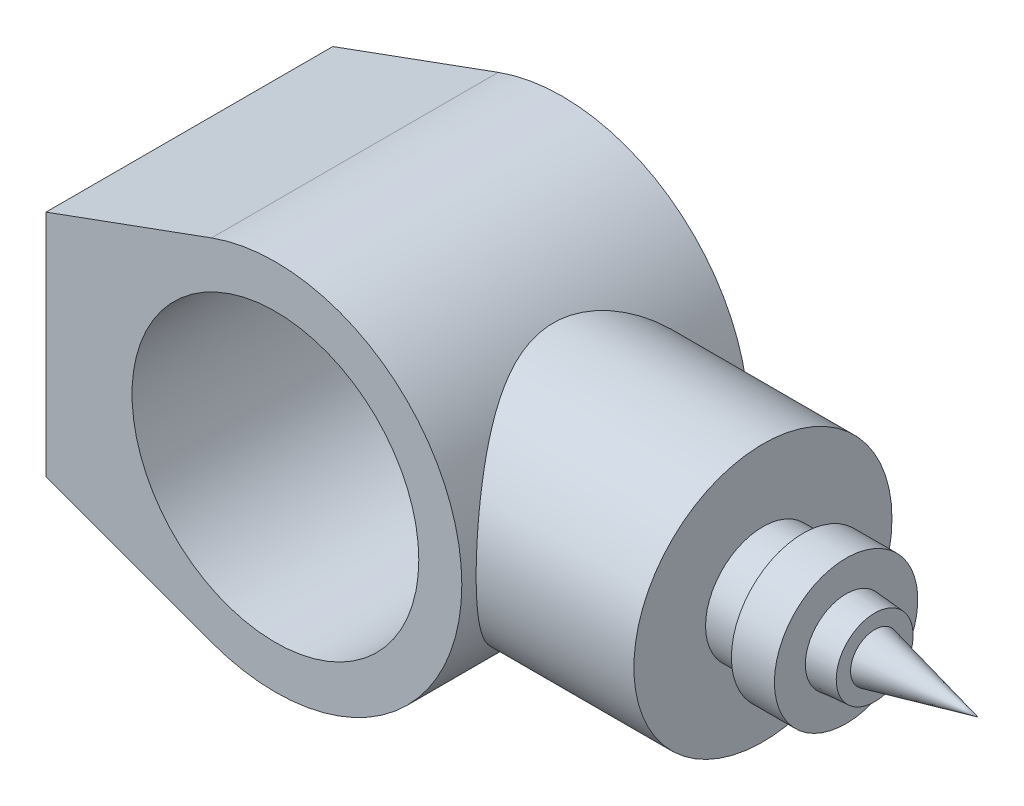
from build123d import *

# Parameters (mm, degrees)
SKETCH1_R                = 50
BOSS_EXTRUDE1_DEPTH      = 50
BOSS_EXTRUDE2_REACH      = 218.16
BOSS_EXTRUDE2_END_RADIUS = 65
SKETCH2_R                = 45


with BuildPart() as part:
    # Sketch1 → Boss-Extrude1 (new, symmetric)
    with BuildSketch(Plane.XY):
        with BuildLine():
            Line((-80, -40), (-80, 40))
            Line((-80, 40), (-22.281665693, 61.061668614))
            ThreePointArc((-22.281665693, 61.061668614), (65, 0), (-22.281665693, -61.061668614))
            Line((-22.281665693, -61.061668614), (-80, -40))
        make_face()
        Circle(SKETCH1_R, mode=Mode.SUBTRACT)
    extrude(amount=BOSS_EXTRUDE1_DEPTH, both=True)

    # Boss-Extrude2: up to this cylinder (the profile starts outside it)
    boss_extrude2_end = Plane(origin=(0, 0, 0), z_dir=(0, 0, -1)) * Cylinder(BOSS_EXTRUDE2_END_RADIUS, 567.32, mode=Mode.PRIVATE)
    # Sketch2 → Boss-Extrude2 (add, up to the surface)
    with BuildSketch(Plane(origin=(120, 0, 0), x_dir=(0, 0, -1), z_dir=(1, 0, 0)), mode=Mode.PRIVATE) as boss_extrude2_sk1:
        Circle(SKETCH2_R)
    boss_extrude2_tool1 = extrude(boss_extrude2_sk1.sketch, amount=-BOSS_EXTRUDE2_REACH, mode=Mode.PRIVATE) - boss_extrude2_end
    add(boss_extrude2_tool1.solids().sort_by_distance((120, 0, 0))[0])

    # Sketch3 → Revolve1 (revolve)
    with BuildSketch(Plane.XY, mode=Mode.PRIVATE) as revolve1_sk:
        Polygon((120, 0), (120, -20), (134, -20), (134, -25), (149, -25), (149, -14.207862831), (158.967942212, -13.407782796), (158.967942212, -8.407782796), (195, 0), align=None)
    revolve(revolve1_sk.sketch.rotate(Axis((0, 0, 0), (1, 0, 0)), 270), axis=Axis((0, 0, 0), (1, 0, 0)))


solid = part.part
